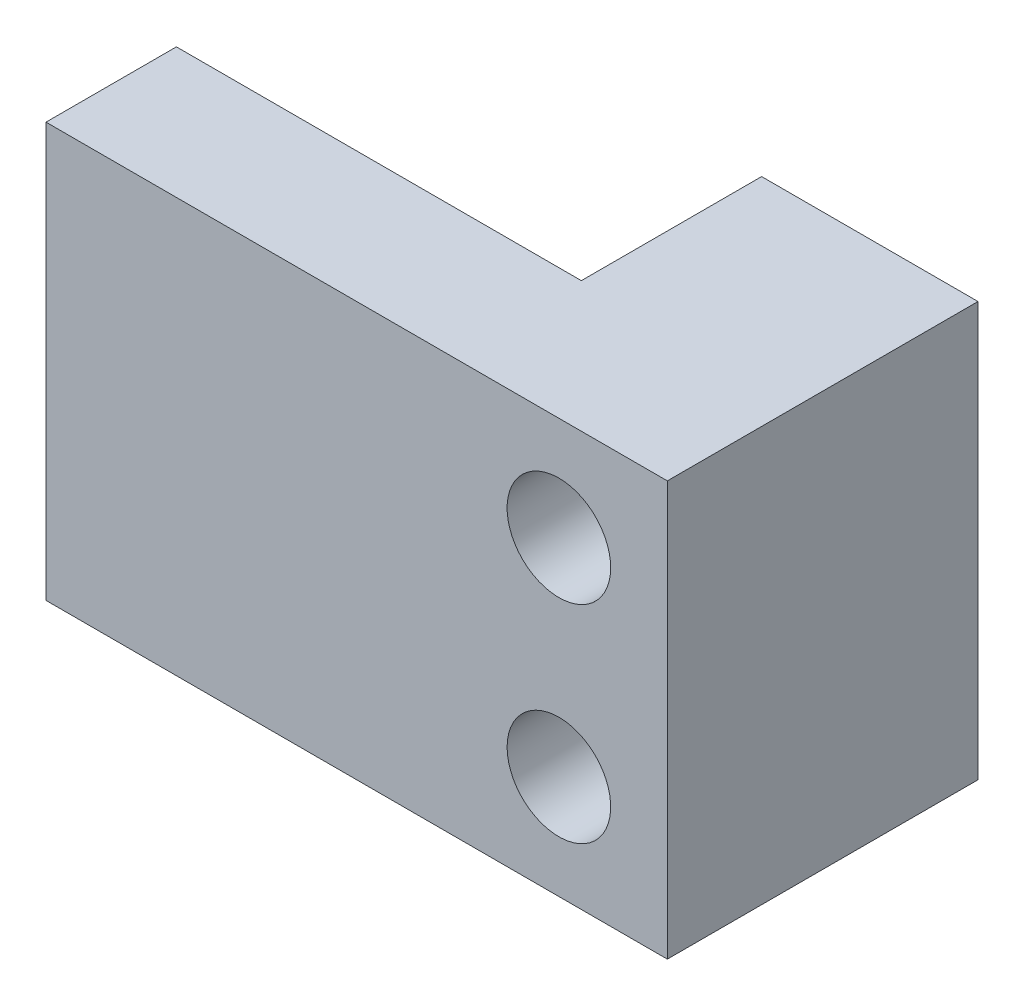
from build123d import *

# Parameters (mm, degrees)
ESQUISSE1_W             = 30
ESQUISSE1_H             = 20
ESQUISSE1_R             = 2.5
BOSS_EXTRU_1_DEPTH      = 15
ESQUISSE2_W             = 19.552131663
ESQUISSE2_H             = 8.703273887
ENL_V_MAT_EXTRU_1_DEPTH = 11


with BuildPart() as part:
    # Esquisse1 → Boss.-Extru.1 (new body)
    with BuildSketch(Plane.XY):
        Rectangle(ESQUISSE1_W, ESQUISSE1_H)
        with Locations((9.763813692, 5)):
            Circle(ESQUISSE1_R, mode=Mode.SUBTRACT)
        with Locations(Location((9.763813692, -5, 0), (0, 0, 180))):
            Circle(ESQUISSE1_R, mode=Mode.SUBTRACT)
    extrude(amount=BOSS_EXTRU_1_DEPTH)

    # Esquisse2 → Enlèv. mat.-Extru.1 (cut)
    with BuildSketch(Plane(origin=(0, 10, 0), x_dir=(1, 0, 0), z_dir=(0, 1, 0))):
        with Locations((-5.223934169, -4.351636943)):
            Rectangle(ESQUISSE2_W, ESQUISSE2_H)
    extrude(amount=-ENL_V_MAT_EXTRU_1_DEPTH, mode=Mode.SUBTRACT)


solid = part.part
